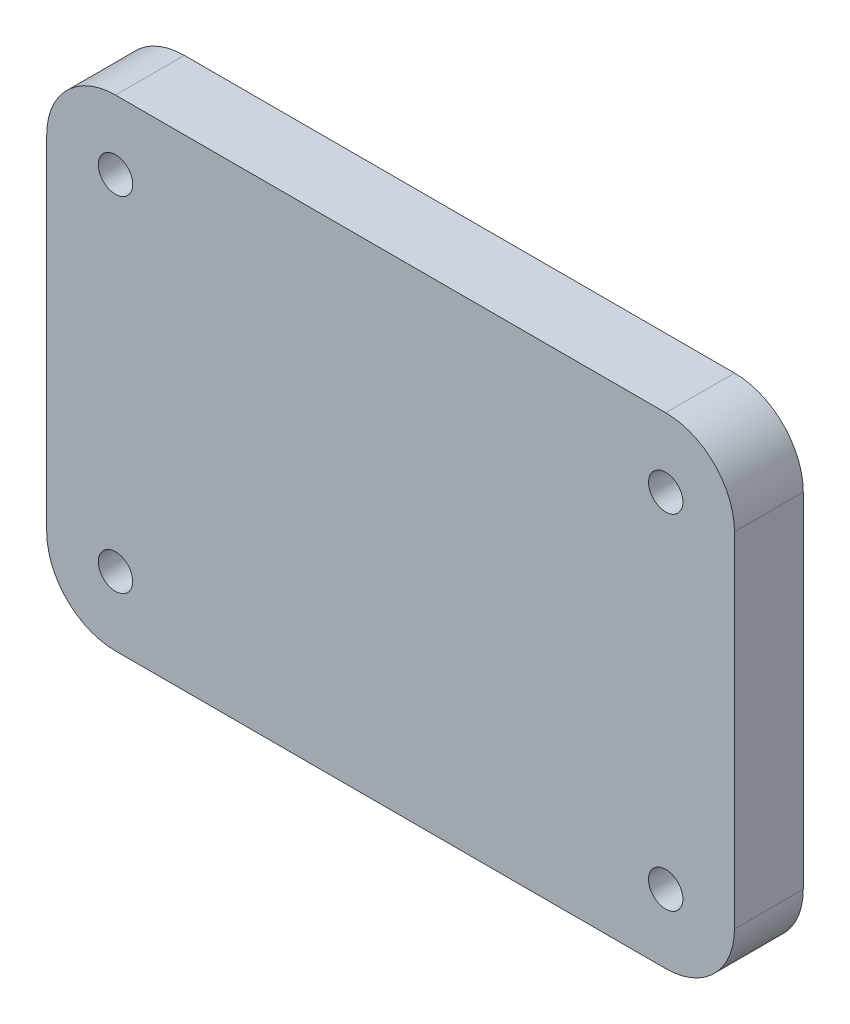
from build123d import *

# Parameters (mm, degrees)
SKETCH1_R           = 2.5
BOSS_EXTRUDE1_DEPTH = 10


with BuildPart() as part:
    # Sketch1 → Boss-Extrude1 (new body)
    with BuildSketch(Plane.XY):
        with BuildLine():
            Line((-40, 35), (40, 35))
            ThreePointArc((40, 35), (47.071067812, 32.071067812), (50, 25))
            Line((50, 25), (50, -25))
            ThreePointArc((50, -25), (47.071067812, -32.071067812), (40, -35))
            Line((40, -35), (-40, -35))
            ThreePointArc((-40, -35), (-47.071067812, -32.071067812), (-50, -25))
            Line((-50, -25), (-50, 25))
            ThreePointArc((-50, 25), (-47.071067812, 32.071067812), (-40, 35))
        make_face()
        with Locations((-40, 25)):
            Circle(SKETCH1_R, mode=Mode.SUBTRACT)
        with Locations((-40, -25)):
            Circle(SKETCH1_R, mode=Mode.SUBTRACT)
        with Locations(Location((40, -25, 0), (0, 0, 180))):
            Circle(SKETCH1_R, mode=Mode.SUBTRACT)
        with Locations(Location((40, 25, 0), (0, 0, 180))):
            Circle(SKETCH1_R, mode=Mode.SUBTRACT)
    extrude(amount=BOSS_EXTRUDE1_DEPTH)


solid = part.part
